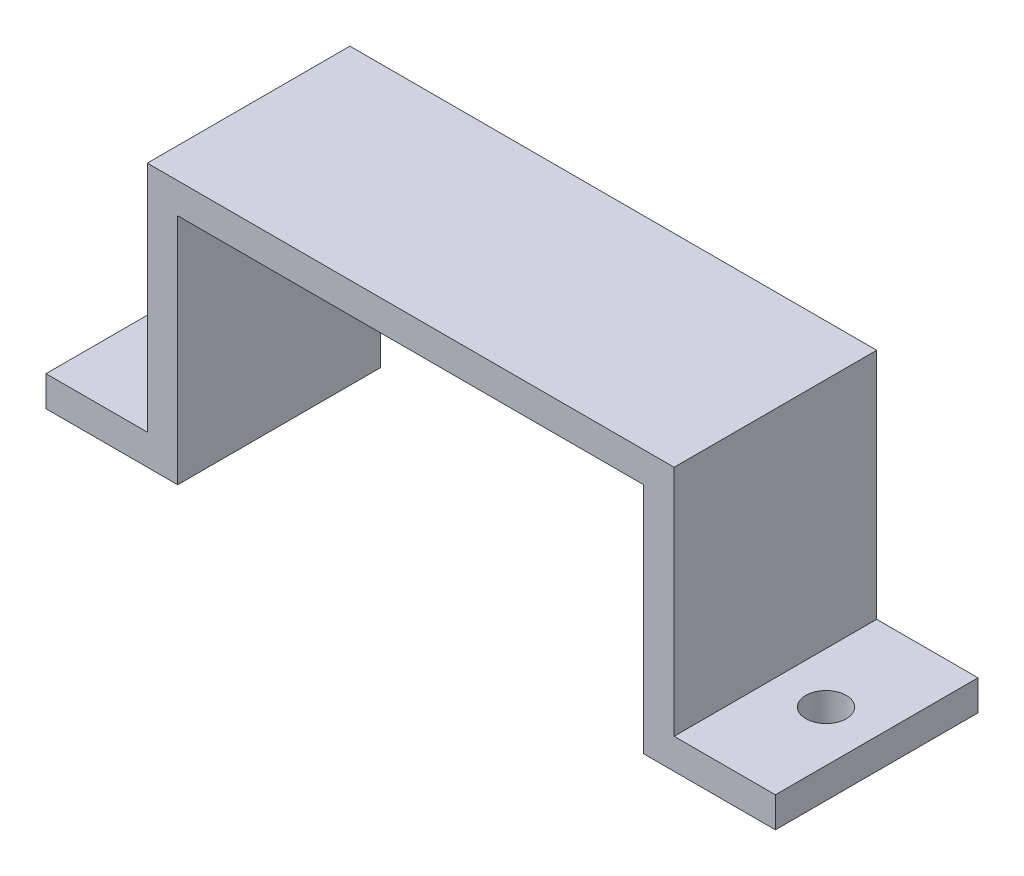
from build123d import *

# Parameters (mm, degrees)
BOSS_EXTRUDE1_DEPTH     = 10
CUT_EXTRUDE1_DEPTH      = 24.58495283
CUT_EXTRUDE1_DEPTH_BACK = 24.58495283
SKETCH2_R               = 1


with BuildPart() as part:
    # Sketch1 → Boss-Extrude1 (new body)
    with BuildSketch(Plane.XY):
        Polygon((-11.5, 0), (-11.5, 10), (11.5, 10), (11.5, 0), (11.5, -1.5), (18, -1.5), (18, 0), (13, 0), (13, 11.5), (-13, 11.5), (-13, 0), (-18, 0), (-18, -1.5), (-11.5, -1.5), align=None)
    extrude(amount=BOSS_EXTRUDE1_DEPTH)

    # Sketch2 → Cut-Extrude1 (cut, two sides: drawn at the far end of the back side and taken through both)
    with BuildSketch(Plane(origin=(0, 0, 0), x_dir=(1, 0, 0), z_dir=(0, 1, 0)).offset(-CUT_EXTRUDE1_DEPTH_BACK)):
        with Locations(Location((-15.5, -5, 0), (0, 0, 180))):
            Circle(SKETCH2_R)
        with Locations((15.5, -5)):
            Circle(SKETCH2_R)
    extrude(amount=CUT_EXTRUDE1_DEPTH + CUT_EXTRUDE1_DEPTH_BACK, mode=Mode.SUBTRACT)


solid = part.part
